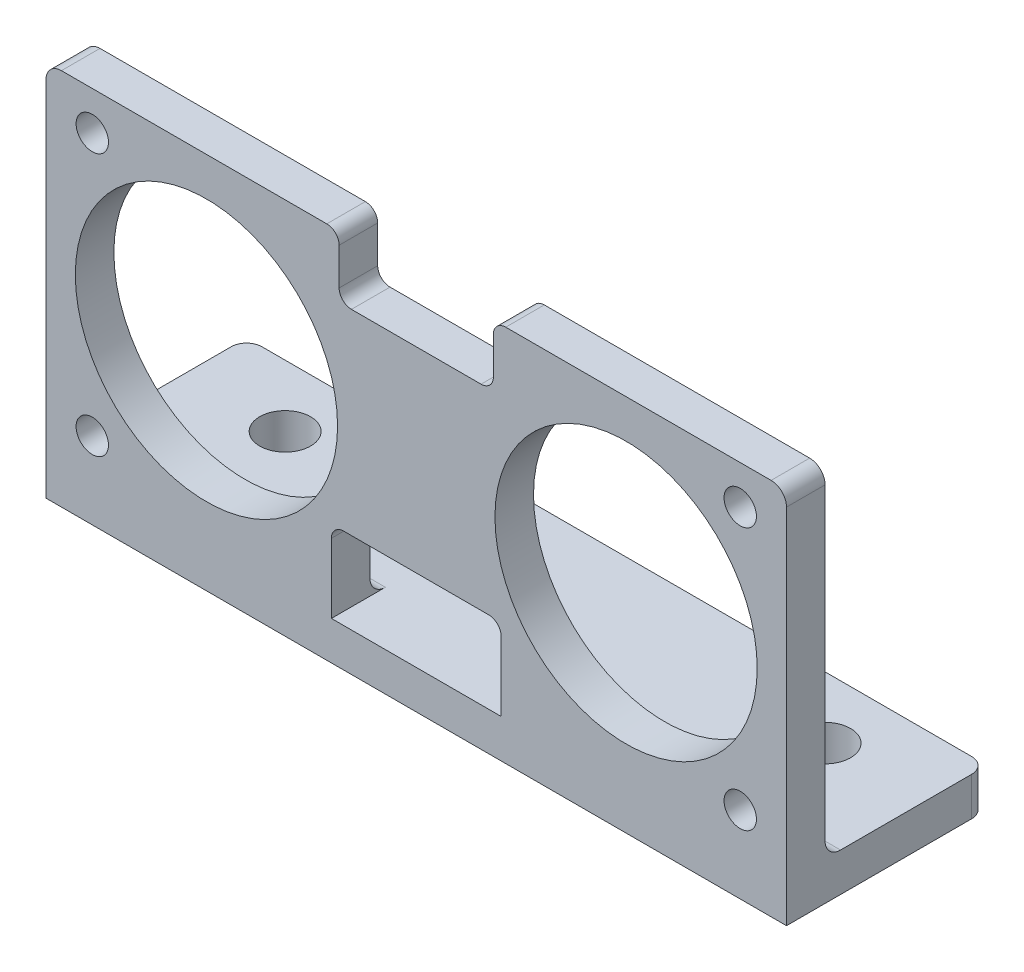
from build123d import *

# Parameters (mm, degrees)
SKETCH_1_R      = 1.05
SKETCH_1_R_2    = 8.5
EXTRUDE_1_DEPTH = 2.5
FILLET_1_R      = 0.8
SKETCH_2_W      = 48
SKETCH_2_H      = 13
SKETCH_2_R      = 1.65
EXTRUDE_2_DEPTH = 2.5
FILLET_2_R      = 1
FILLET_3_R      = 1


with BuildPart() as part:
    # 草图1 → 凸台-拉伸1 (new body)
    with BuildSketch(Plane.XY):
        Polygon((-24, 11), (-24, -11), (-5.5, -11), (-5.5, -5.7), (5.5, -5.7), (5.5, -11), (24, -11), (24, 11), (5, 11), (5, 7), (-5, 7), (-5, 11), align=None)
        with Locations((-21, -8.5)):
            Circle(SKETCH_1_R, mode=Mode.SUBTRACT)
        with Locations((21, -8.5)):
            Circle(SKETCH_1_R, mode=Mode.SUBTRACT)
        with Locations((-13.6, 0)):
            Circle(SKETCH_1_R_2, mode=Mode.SUBTRACT)
        with Locations((-21, 8.5)):
            Circle(SKETCH_1_R, mode=Mode.SUBTRACT)
        with Locations((13.6, 0)):
            Circle(SKETCH_1_R_2, mode=Mode.SUBTRACT)
        with Locations((21, 8.5)):
            Circle(SKETCH_1_R, mode=Mode.SUBTRACT)
    extrude(amount=EXTRUDE_1_DEPTH)

    # 圆角1
    fillet_1_edges = [part.edges().sort_by_distance(p)[0] for p in [
        (5, 11, 1.25),
        (5.5, -5.7, 1.25),
        (-5.5, -5.7, 1.25),
        (-5, 11, 1.25),
        (-5, 7, 1.25),
        (5, 7, 1.25),
    ]]
    fillet(fillet_1_edges, radius=FILLET_1_R)

    # 草图2 → 凸台-拉伸2 (add)
    with BuildSketch(Plane.XZ.offset(11)):
        with Locations((0, -4)):
            Rectangle(SKETCH_2_W, SKETCH_2_H)
        with Locations(Location((-17.5, -6.5, 0), (0, 0, 270))):
            Circle(SKETCH_2_R, mode=Mode.SUBTRACT)
        with Locations(Location((17.5, -6.5, 0), (0, 0, 270))):
            Circle(SKETCH_2_R, mode=Mode.SUBTRACT)
    extrude(amount=EXTRUDE_2_DEPTH)

    # 圆角2
    fillet_2_edges = [part.edges().sort_by_distance(p)[0] for p in [
        (14.75, -11, 0),
        (-14.75, -11, 0),
    ]]
    fillet(fillet_2_edges, radius=FILLET_2_R)

    # 圆角3
    fillet_3_edges = [part.edges().sort_by_distance(p)[0] for p in [
        (24, 11, 1.25),
        (-24, 11, 1.25),
        (-24, -12.25, -10.5),
        (24, -12.25, -10.5),
    ]]
    fillet(fillet_3_edges, radius=FILLET_3_R)


solid = part.part
